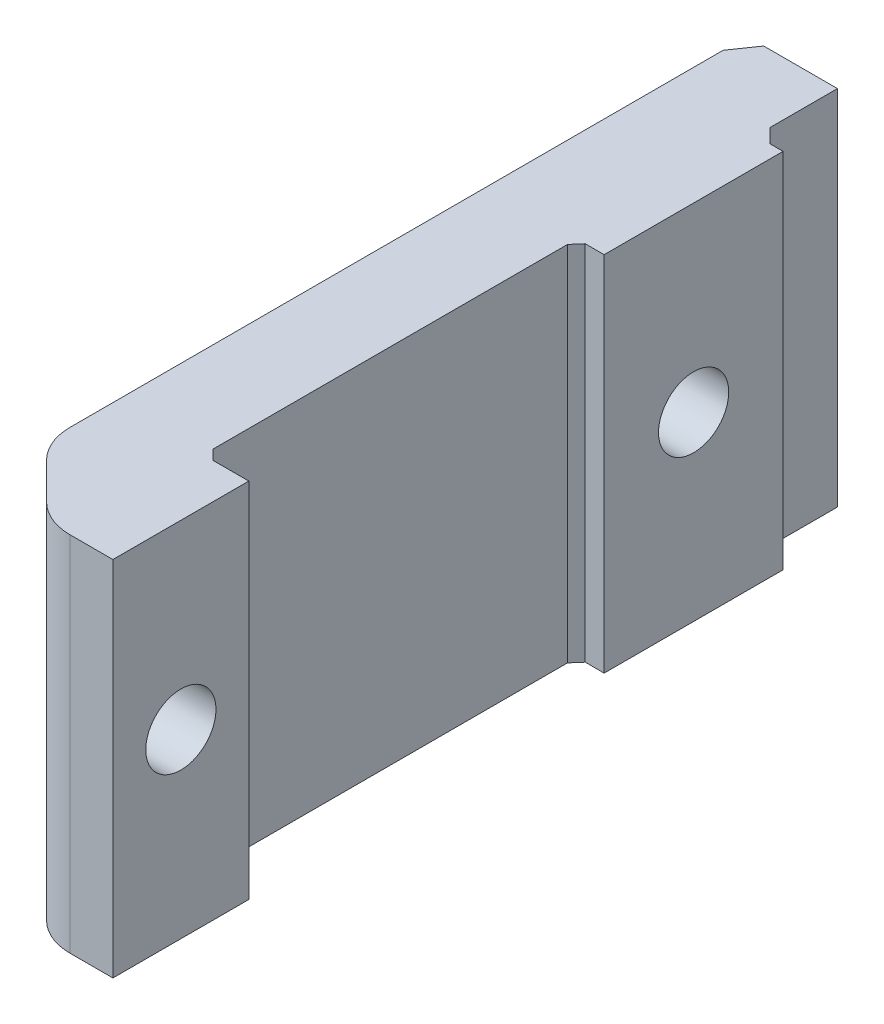
from build123d import *

# Parameters (mm, degrees)
EXTRUDE_1_DEPTH          = 16
CUT_EXTRUDE_1_DEPTH      = 31.882108434
CUT_EXTRUDE_1_DEPTH_BACK = 31.882108434
SKETCH_2_R               = 1.55


with BuildPart() as part:
    # ｽｹｯﾁ1 → ﾎﾞｽ - 押し出し1 (new body)
    with BuildSketch(Plane(origin=(0, 0, 0), x_dir=(1, 0, 0), z_dir=(0, 1, 0))):
        with BuildLine():
            Line((1.311036439, 22.922778474), (1.311036439, 25.896873144))
            Line((1.311036439, 25.896873144), (-1.944631198, 25.896873144))
            Line((-1.944631198, 25.896873144), (-2.690557808, 24.817055549))
            Line((-2.690557808, 24.817055549), (-2.676864245, 24.830749112))
            Line((-2.676864245, 24.830749112), (-2.676864245, 17.239005736))
            Line((-2.676864245, 17.239005736), (-2.676864245, -3.996970874))
            ThreePointArc((-2.676864245, -3.996970874), (-2.486563076, -4.953679455), (-1.944631198, -5.764737827))
            Line((-1.944631198, -5.764737827), (-0.338475216, -7.370893809))
            ThreePointArc((-0.338475216, -7.370893809), (0.472583156, -7.912825688), (1.429291737, -8.103126856))
            Line((1.429291737, -8.103126856), (3.323135755, -8.103126856))
            Line((3.323135755, -8.103126856), (3.323135755, -2.103126856))
            Line((3.323135755, -2.103126856), (1.751325003, -2.103126856))
            Line((1.751325003, -2.103126856), (1.311036439, -1.662838292))
            Line((1.311036439, -1.662838292), (1.311036439, 13.978392046))
            Line((1.311036439, 13.978392046), (1.674004174, 14.396873144))
            Line((1.674004174, 14.396873144), (2.511036439, 14.396873144))
            Line((2.511036439, 14.396873144), (2.511036439, 22.296873144))
            Line((2.511036439, 22.296873144), (1.936941769, 22.296873144))
            Line((1.936941769, 22.296873144), (1.311036439, 22.922778474))
        make_face()
    extrude(amount=EXTRUDE_1_DEPTH)

    # ｽｹｯﾁ2 → ｶｯﾄ - 押し出し1 (cut, two sides: drawn at the far end of the back side and taken through both)
    with BuildSketch(Plane(origin=(2.511036439, 0, 0), x_dir=(0, 0, -1), z_dir=(1, 0, 0)).offset(-CUT_EXTRUDE_1_DEPTH_BACK)):
        with Locations(Location((18.346873144, 8, 0), (0, 0, 180))):
            Circle(SKETCH_2_R)
        with Locations((-5.103126856, 8)):
            Circle(SKETCH_2_R)
    extrude(amount=CUT_EXTRUDE_1_DEPTH + CUT_EXTRUDE_1_DEPTH_BACK, mode=Mode.SUBTRACT)


solid = part.part
